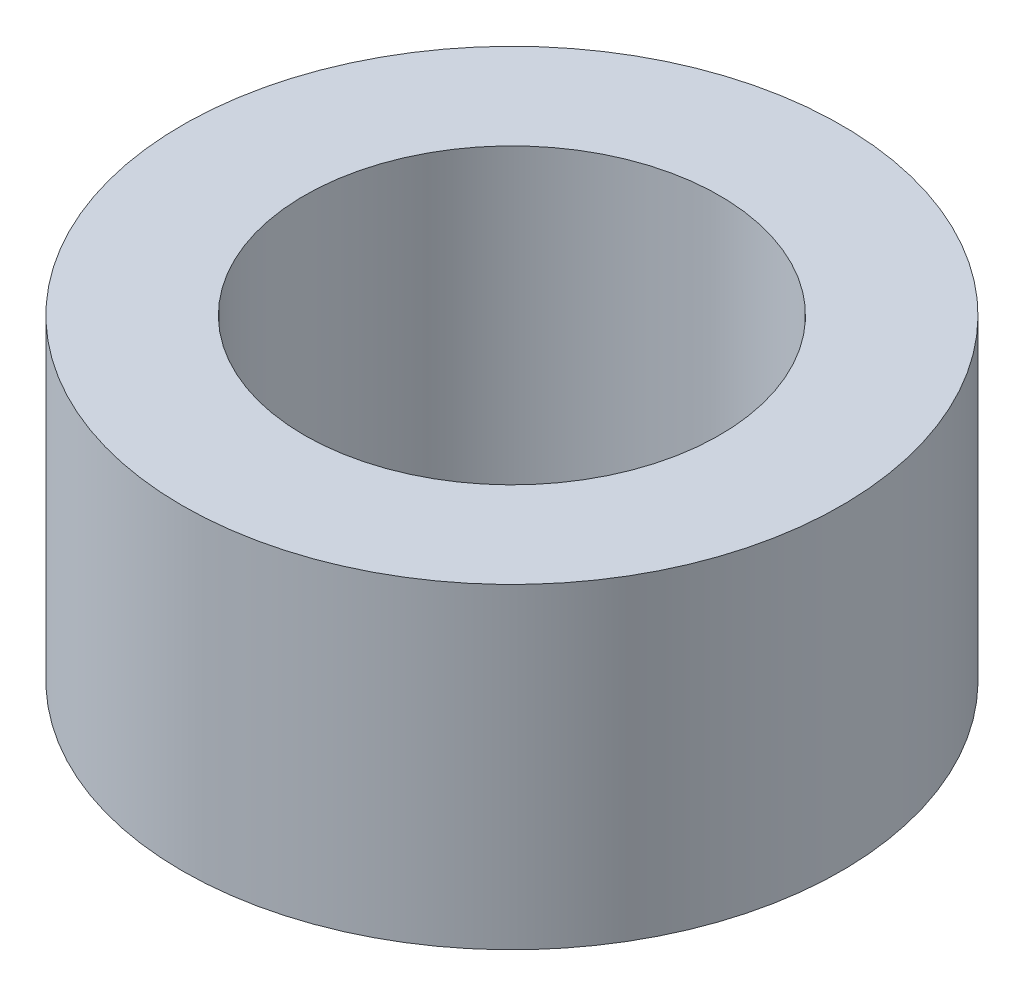
from build123d import *

# Parameters (mm, degrees)
SKETCH2_R           = 3.175
SKETCH2_R_2         = 2
BOSS_EXTRUDE1_DEPTH = 3.048


with BuildPart() as part:
    # Sketch2 → Boss-Extrude1 (new body)
    with BuildSketch(Plane(origin=(0, 0, 0), x_dir=(1, 0, 0), z_dir=(0, 1, 0))):
        with Locations(Location((0, 0, 0), (0, 0, 270))):
            Circle(SKETCH2_R)
        with Locations(Location((0, 0, 0), (0, 0, 270))):
            Circle(SKETCH2_R_2, mode=Mode.SUBTRACT)
    extrude(amount=-BOSS_EXTRUDE1_DEPTH)


solid = part.part
